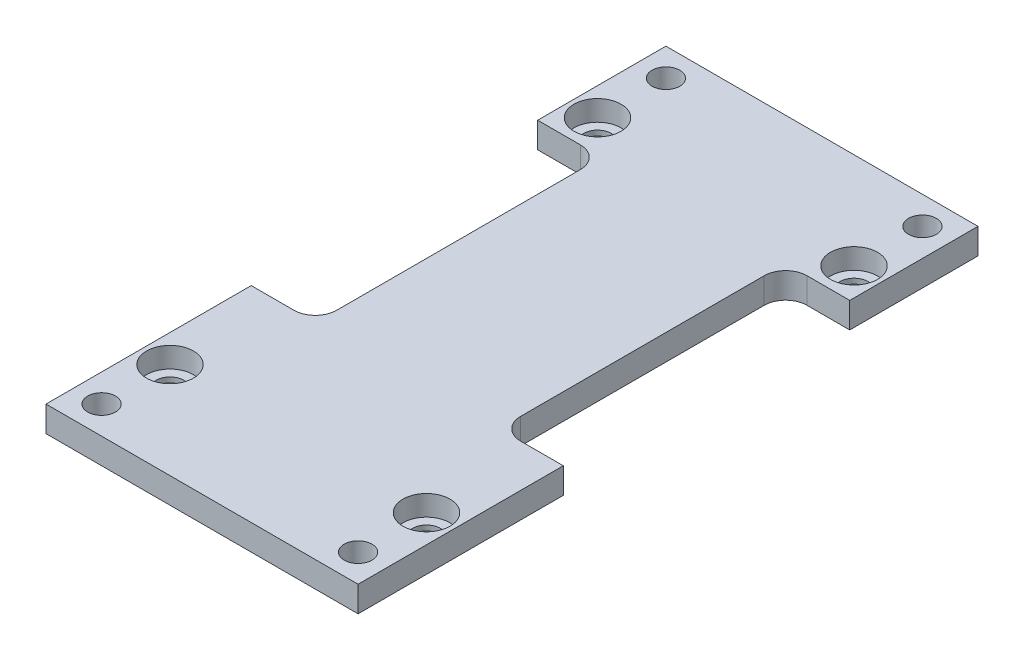
from build123d import *

# Parameters (mm, degrees)
BOSS_EXTRUDE1_DEPTH = 6
SKETCH2_R           = 3.25
CUT_EXTRUDE1_DEPTH  = 82.391031447
SKETCH3_R           = 5.5
CUT_EXTRUDE2_DEPTH  = 4.8


with BuildPart() as part:
    # Sketch1 → Boss-Extrude1 (new body)
    with BuildSketch(Plane(origin=(0, 0, 0), x_dir=(1, 0, 0), z_dir=(0, 1, 0))):
        with BuildLine():
            Line((-36.5, -72.5), (36.5, -72.5))
            Line((36.5, -72.5), (36.5, -24.5))
            Line((36.5, -24.5), (26.5, -24.5))
            ThreePointArc((26.5, -24.5), (22.964466094, -23.035533906), (21.5, -19.5))
            Line((21.5, -19.5), (21.5, 37.5))
            ThreePointArc((21.5, 37.5), (22.964466094, 41.035533906), (26.5, 42.5))
            Line((26.5, 42.5), (36.5, 42.5))
            Line((36.5, 42.5), (36.5, 72.5))
            Line((36.5, 72.5), (-36.5, 72.5))
            Line((-36.5, 72.5), (-36.5, 42.5))
            Line((-36.5, 42.5), (-26.5, 42.5))
            ThreePointArc((-26.5, 42.5), (-22.964466094, 41.035533906), (-21.5, 37.5))
            Line((-21.5, 37.5), (-21.5, -19.5))
            ThreePointArc((-21.5, -19.5), (-22.964466094, -23.035533906), (-26.5, -24.5))
            Line((-26.5, -24.5), (-36.5, -24.5))
            Line((-36.5, -24.5), (-36.5, -72.5))
        make_face()
    extrude(amount=BOSS_EXTRUDE1_DEPTH)

    # Sketch2 → Cut-Extrude1 (cut, through all)
    with BuildSketch(Plane(origin=(0, 6, 0), x_dir=(1, 0, 0), z_dir=(0, 1, 0))):
        with Locations(Location((-30, 66, 0), (0, 0, 270))):
            Circle(SKETCH2_R)
        with Locations(Location((-30, 50, 0), (0, 0, 270))):
            Circle(SKETCH2_R)
        with Locations(Location((30, 50, 0), (0, 0, 90))):
            Circle(SKETCH2_R)
        with Locations(Location((30, 66, 0), (0, 0, 90))):
            Circle(SKETCH2_R)
        with Locations(Location((30, -50, 0), (0, 0, 270))):
            Circle(SKETCH2_R)
        with Locations(Location((30, -66, 0), (0, 0, 270))):
            Circle(SKETCH2_R)
        with Locations(Location((-30, -50, 0), (0, 0, 90))):
            Circle(SKETCH2_R)
        with Locations(Location((-30, -66, 0), (0, 0, 90))):
            Circle(SKETCH2_R)
    extrude(amount=-CUT_EXTRUDE1_DEPTH, mode=Mode.SUBTRACT)

    # Sketch3 → Cut-Extrude2 (cut)
    with BuildSketch(Plane(origin=(0, 6, 0), x_dir=(1, 0, 0), z_dir=(0, 1, 0))):
        with Locations(Location((-30, 50, 0), (0, 0, 270))):
            Circle(SKETCH3_R)
        with Locations(Location((30, 50, 0), (0, 0, 90))):
            Circle(SKETCH3_R)
        with Locations(Location((30, -50, 0), (0, 0, 270))):
            Circle(SKETCH3_R)
        with Locations(Location((-30, -50, 0), (0, 0, 90))):
            Circle(SKETCH3_R)
    extrude(amount=-CUT_EXTRUDE2_DEPTH, mode=Mode.SUBTRACT)


solid = part.part
